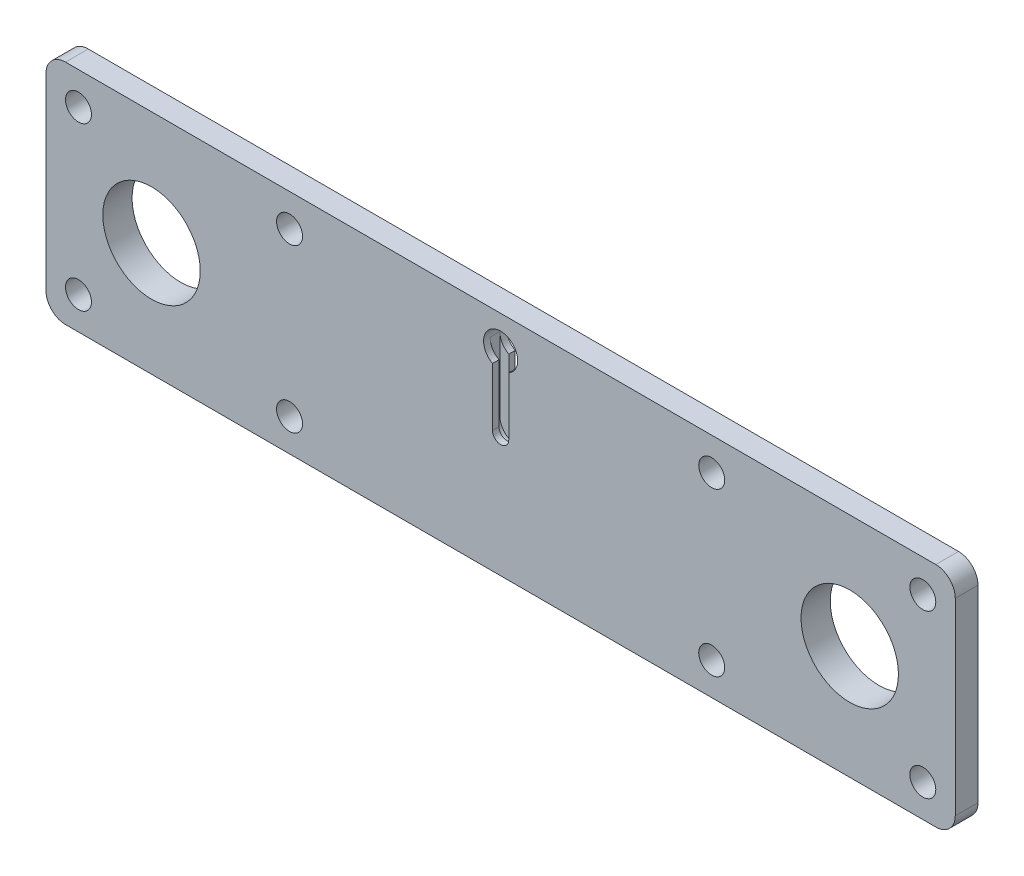
from build123d import *

# Parameters (mm, degrees)
SKETCH1_W           = 280
SKETCH1_H           = 70
BOSS_EXTRUDE1_DEPTH = 7
FILLET1_R           = 6
SKETCH2_R           = 15
SKETCH2_R_2         = 4
CUT_EXTRUDE1_DEPTH  = 10
BOSS_EXTRUDE2_START = 2
SKETCH3_R           = 20
SKETCH3_R_2         = 15
BOSS_EXTRUDE2_DEPTH = 2
CUT_EXTRUDE2_DEPTH  = 3


with BuildPart() as part:
    # Sketch1 → Boss-Extrude1 (new body)
    with BuildSketch(Plane.XY):
        Rectangle(SKETCH1_W, SKETCH1_H)
    extrude(amount=BOSS_EXTRUDE1_DEPTH)

    # Fillet1
    fillet1_edges = [part.edges().sort_by_distance(p)[0] for p in [
        (140, -35, 3.5),
        (-140, -35, 3.5),
        (-140, 35, 3.5),
        (140, 35, 3.5),
    ]]
    fillet(fillet1_edges, radius=FILLET1_R)

    # Sketch2 → Cut-Extrude1 (cut)
    with BuildSketch(Plane(origin=(0, 0, 0), x_dir=(-1, 0, 0), z_dir=(0, 0, -1))):
        with Locations((-107.5, 0)):
            Circle(SKETCH2_R)
        with Locations((107.5, 0)):
            Circle(SKETCH2_R)
        with Locations((130, 25)):
            Circle(SKETCH2_R_2)
        with Locations((65, 25)):
            Circle(SKETCH2_R_2)
        with Locations((-65, 25)):
            Circle(SKETCH2_R_2)
        with Locations((-130, 25)):
            Circle(SKETCH2_R_2)
        with Locations(Location((-130, -25, 0), (0, 0, 180))):
            Circle(SKETCH2_R_2)
        with Locations(Location((-65, -25, 0), (0, 0, 180))):
            Circle(SKETCH2_R_2)
        with Locations(Location((65, -25, 0), (0, 0, 180))):
            Circle(SKETCH2_R_2)
        with Locations(Location((130, -25, 0), (0, 0, 180))):
            Circle(SKETCH2_R_2)
        with BuildLine():
            Line((-2.5, 2.5), (-2.5, 20.383453672))
            ThreePointArc((-2.5, 20.383453672), (0, 30.25), (2.5, 20.383453672))
            Line((2.5, 20.383453672), (2.5, 2.5))
            ThreePointArc((2.5, 2.5), (0, 0), (-2.5, 2.5))
        make_face()
    extrude(amount=-CUT_EXTRUDE1_DEPTH, mode=Mode.SUBTRACT)

    # Sketch3 → Boss-Extrude2 (add)
    # profile 1 of 2: a face of its own
    with BuildSketch(Plane(origin=(0, 0, 0), x_dir=(-1, 0, 0), z_dir=(0, 0, -1)).offset(BOSS_EXTRUDE2_START)):
        with Locations(Location((-107.5, 0, 0), (0, 0, 180))):
            Circle(SKETCH3_R)
        with Locations((-107.5, 0)):
            Circle(SKETCH3_R_2, mode=Mode.SUBTRACT)
    # profile 2 of 2: a face of its own
    with BuildSketch(Plane(origin=(0, 0, 0), x_dir=(-1, 0, 0), z_dir=(0, 0, -1)).offset(BOSS_EXTRUDE2_START)):
        with Locations(Location((107.5, 0, 0), (0, 0, 180))):
            Circle(SKETCH3_R)
        with Locations((107.5, 0)):
            Circle(SKETCH3_R_2, mode=Mode.SUBTRACT)
    extrude(amount=-BOSS_EXTRUDE2_DEPTH)

    # Sketch4 → Cut-Extrude2 (cut)
    with BuildSketch(Plane(origin=(0, 0, 2), x_dir=(-1, 0, 0), z_dir=(0, 0, -1))):
        with BuildLine():
            Line((0, 25), (-5.25, 25))
            Line((-5.25, 25), (-5.25, 2.5))
            ThreePointArc((-5.25, 2.5), (0, -2.75), (5.25, 2.5))
            Line((5.25, 2.5), (5.25, 25))
            Line((5.25, 25), (0, 25))
        make_face()
    extrude(amount=-CUT_EXTRUDE2_DEPTH, mode=Mode.SUBTRACT)


solid = part.part
